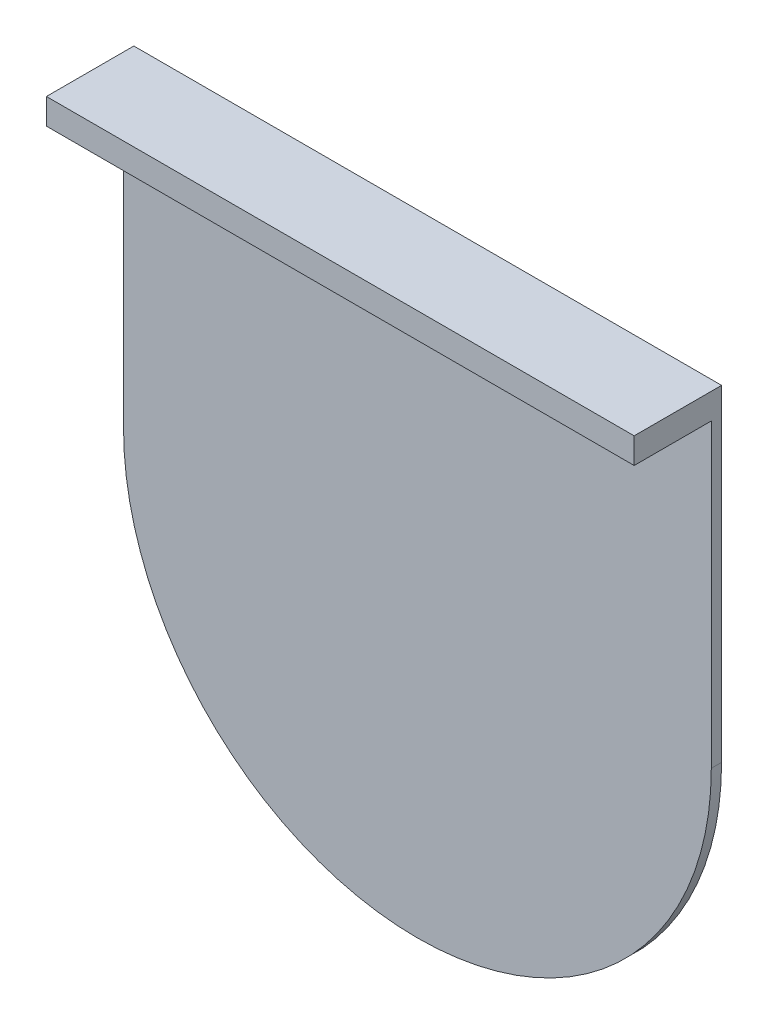
from build123d import *

# Parameters (mm, degrees)
BOSS_EXTRUDE3_DEPTH = 2
SKETCH4_W           = 114.3
SKETCH4_H           = 5
BOSS_EXTRUDE4_DEPTH = 15


with BuildPart() as part:
    # Sketch3 → Boss-Extrude3 (new body)
    with BuildSketch(Plane.XY):
        with BuildLine():
            Line((-57.15, 120.65), (57.15, 120.65))
            Line((57.15, 120.65), (57.15, 57.15))
            ThreePointArc((57.15, 57.15), (0, 0), (-57.15, 57.15))
            Line((-57.15, 57.15), (-57.15, 120.65))
        make_face()
    extrude(amount=BOSS_EXTRUDE3_DEPTH)

    # Sketch4 → Boss-Extrude4 (add)
    with BuildSketch(Plane.XY.offset(2)):
        with Locations((0, 118.15)):
            Rectangle(SKETCH4_W, SKETCH4_H)
    extrude(amount=BOSS_EXTRUDE4_DEPTH)


solid = part.part
